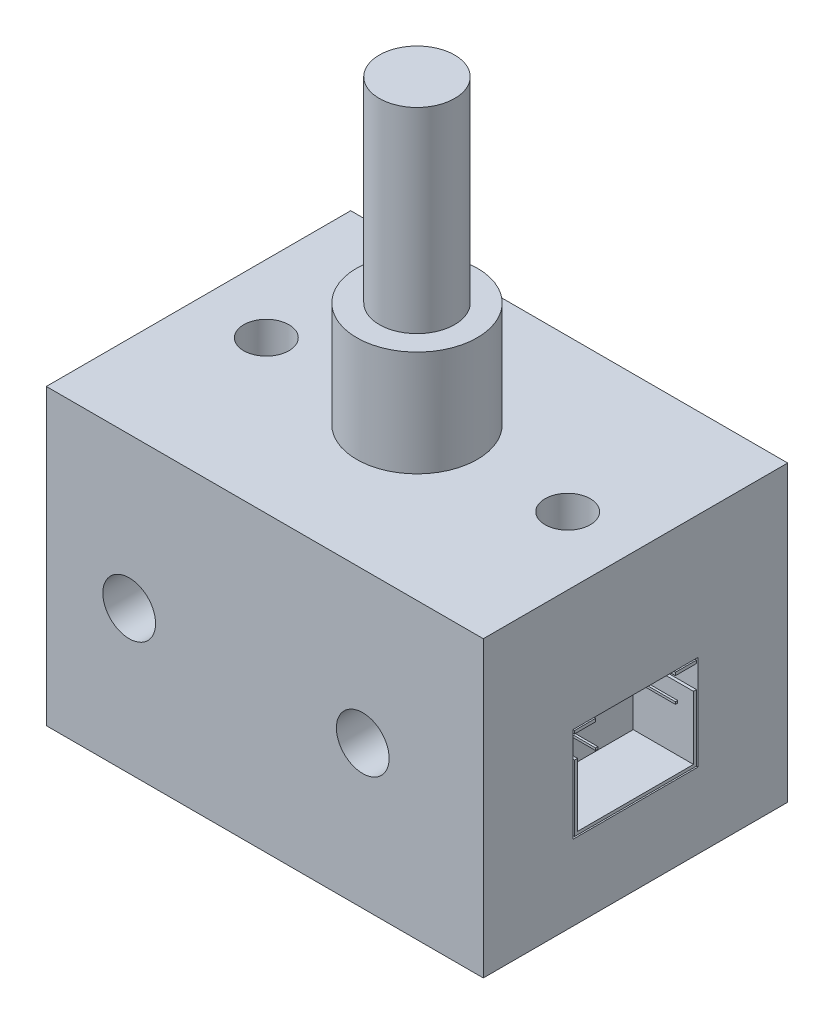
from build123d import *

# Parameters (mm, degrees)
SKETCH1_W                              = 29
SKETCH1_H                              = 19.5
SKETCH1_R                              = 1.75
FRONTPROFILEBOSS_EXTRUDE1_DEPTH        = 20.2
SKETCH2_R                              = 1.5
TOPMOUNTINGHOLESCUT_EXTRUDE1_DEPTH     = 4
SKETCH3_R                              = 4
CONNINGTOWERBOSS_EXTRUDE2_DEPTH        = 7
SKETCH4_R                              = 2.5
PLUNGERBOSS_EXTRUDE3_DEPTH             = 13
SKETCH5_R                              = 3
BACKMOUNTINGHOLESBORCUT_EXTRUDE2_DEPTH = 6
SKETCH6_W                              = 8.3
SKETCH6_H                              = 6.3
XHTERMINALCUT_EXTRUDE14_DEPTH          = 4
SKETCH7_W                              = 1.4
SKETCH7_H                              = 0.2
SKETCH7_W_2                            = 0.15
SKETCH7_H_2                            = 0.15
XHTERMINALBOSS_EXTRUDE4_DEPTH          = 4


with BuildPart() as part:
    # Sketch1 → FrontProfileBoss-Extrude1 (new body)
    with BuildSketch(Plane.XY):
        with Locations((14.5, 9.75)):
            Rectangle(SKETCH1_W, SKETCH1_H)
        with Locations((5.5, 9.5)):
            Circle(SKETCH1_R, mode=Mode.SUBTRACT)
        with Locations((21, 9.5)):
            Circle(SKETCH1_R, mode=Mode.SUBTRACT)
    extrude(amount=FRONTPROFILEBOSS_EXTRUDE1_DEPTH)

    # Sketch2 → TopMountingHolesCut-Extrude1 (cut)
    with BuildSketch(Plane(origin=(0, 19.5, 0), x_dir=(1, 0, 0), z_dir=(0, 1, 0))):
        with Locations(Location((4.5, -10.1, 0), (0, 0, 270))):
            Circle(SKETCH2_R)
        with Locations(Location((24.5, -10.1, 0), (0, 0, 270))):
            Circle(SKETCH2_R)
    extrude(amount=-TOPMOUNTINGHOLESCUT_EXTRUDE1_DEPTH, mode=Mode.SUBTRACT)

    # Sketch3 → ConningTowerBoss-Extrude2 (add)
    with BuildSketch(Plane(origin=(0, 19.5, 0), x_dir=(1, 0, 0), z_dir=(0, 1, 0))):
        with Locations(Location((14.5, -10.1, 0), (0, 0, 90))):
            Circle(SKETCH3_R)
    extrude(amount=CONNINGTOWERBOSS_EXTRUDE2_DEPTH)

    # Sketch4 → PlungerBoss-Extrude3 (add)
    with BuildSketch(Plane(origin=(0, 26.5, 0), x_dir=(1, 0, 0), z_dir=(0, 1, 0))):
        with Locations(Location((14.5, -10.1, 0), (0, 0, 90))):
            Circle(SKETCH4_R)
    extrude(amount=PLUNGERBOSS_EXTRUDE3_DEPTH)

    # Sketch5 → BackMountingHolesBorCut-Extrude2 (cut)
    with BuildSketch(Plane(origin=(0, 0, 0), x_dir=(-1, 0, 0), z_dir=(0, 0, -1))):
        with Locations((-21, 9.5)):
            Circle(SKETCH5_R)
        with Locations((-5.5, 9.5)):
            Circle(SKETCH5_R)
    extrude(amount=-BACKMOUNTINGHOLESBORCUT_EXTRUDE2_DEPTH, mode=Mode.SUBTRACT)

    # Sketch6 → XHTerminalCut-Extrude14 (cut)
    with BuildSketch(Plane(origin=(29, 0, 0), x_dir=(0, 0, -1), z_dir=(1, 0, 0))):
        with Locations((-10.1, 8.15)):
            Rectangle(SKETCH6_W, SKETCH6_H)
    extrude(amount=-XHTERMINALCUT_EXTRUDE14_DEPTH, mode=Mode.SUBTRACT)

    # Sketch7 → XHTerminalBoss-Extrude4 (add)
    with BuildSketch(Plane(origin=(25, 0, 0), x_dir=(0, 0, -1), z_dir=(1, 0, 0))):
        Polygon((-14.15, 9.5), (-14.15, 5.1), (-6.05, 5.1), (-6.05, 9.5), (-6.25, 9.5), (-6.25, 5.3), (-13.95, 5.3), (-13.95, 9.5), align=None)
        with Locations((-13.45, 11.1)):
            Rectangle(SKETCH7_W, SKETCH7_H)
        with Locations((-6.75, 11.1)):
            Rectangle(SKETCH7_W, SKETCH7_H)
        with Locations((-12.675, 9.425)):
            Rectangle(SKETCH7_W_2, SKETCH7_H_2)
        with Locations((-7.375, 9.425)):
            Rectangle(SKETCH7_W_2, SKETCH7_H_2)
    extrude(amount=XHTERMINALBOSS_EXTRUDE4_DEPTH)


solid = part.part
